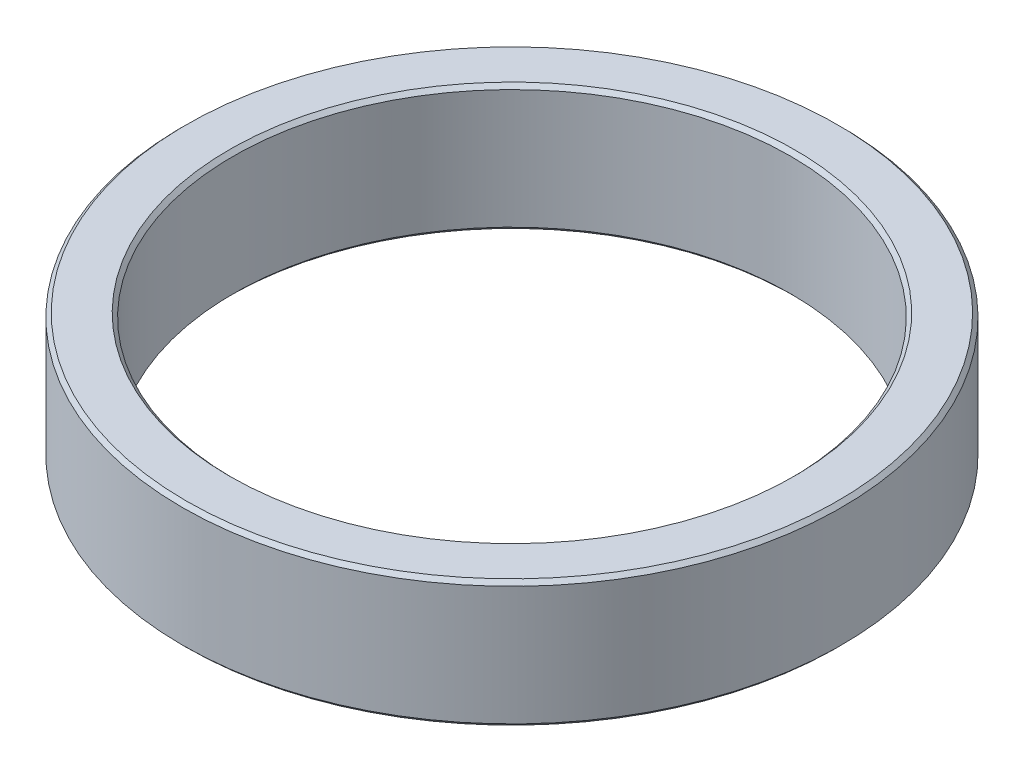
from build123d import *

# Parameters (mm, degrees)
SKETCH1_R           = 13
SKETCH1_R_2         = 11
BOSS_EXTRUDE1_DEPTH = 5
CHAMFER1_SIZE       = 0.15


with BuildPart() as part:
    # Sketch1 → Boss-Extrude1 (new body)
    with BuildSketch(Plane(origin=(0, 0, 0), x_dir=(1, 0, 0), z_dir=(0, 1, 0))):
        with Locations(Location((0, 0, 0), (0, 0, 270))):
            Circle(SKETCH1_R)
        with Locations(Location((0, 0, 0), (0, 0, 270))):
            Circle(SKETCH1_R_2, mode=Mode.SUBTRACT)
    extrude(amount=BOSS_EXTRUDE1_DEPTH)

    # Chamfer1
    chamfer1_edges = [part.edges().sort_by_distance(p)[0] for p in [
        (0, 0, -13),
        (0, 5, -13),
        (0, 0, -11),
        (0, 5, -11),
    ]]
    chamfer(chamfer1_edges, length=CHAMFER1_SIZE)


solid = part.part
